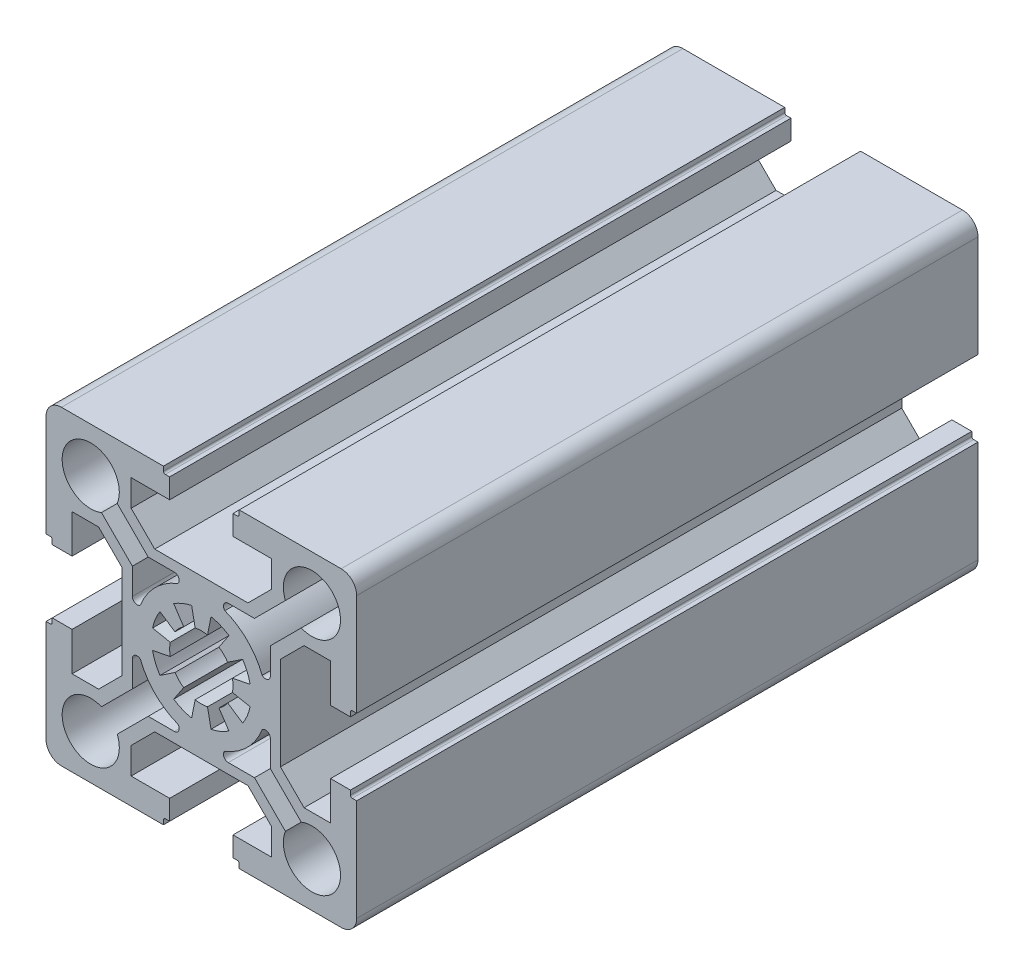
from build123d import *

# Parameters (mm, degrees)
EXTRUDE_1_DEPTH = 100


with BuildPart() as part:
    # 草图1 → 凸台-拉伸1 (new body)
    with BuildSketch(Plane.XY):
        with BuildLine():
            Line((-4.765977756, 26.059817672), (-21.165977756, 26.059817672))
            ThreePointArc((-21.165977756, 26.059817672), (-22.933744709, 25.327584625), (-23.665977756, 23.559817672))
            Line((-23.665977756, 23.559817672), (-23.665977756, 7.159817672))
            Line((-23.665977756, 7.159817672), (-22.965977756, 7.159817672))
            ThreePointArc((-22.965977756, 7.159817672), (-22.753845722, 7.071949706), (-22.665977756, 6.859817672))
            Line((-22.665977756, 6.859817672), (-22.665977756, 6.159817672))
            Line((-22.665977756, 6.159817672), (-19.465977756, 6.159817672))
            Line((-19.465977756, 6.159817672), (-19.465977756, 12.359817672))
            Line((-19.465977756, 12.359817672), (-15.198567937, 12.359817672))
            Line((-15.198567937, 12.359817672), (-11.398567937, 8.559817672))
            Line((-11.398567937, 8.559817672), (-11.398567937, 1.059817672))
            Line((-11.398567937, 1.059817672), (-11.398567937, -6.440182328))
            Line((-11.398567937, -6.440182328), (-15.198567937, -10.240182328))
            Line((-15.198567937, -10.240182328), (-19.465977756, -10.240182328))
            Line((-19.465977756, -10.240182328), (-19.465977756, -4.040182328))
            Line((-19.465977756, -4.040182328), (-22.665977756, -4.040182328))
            Line((-22.665977756, -4.040182328), (-22.665977756, -4.740182328))
            ThreePointArc((-22.665977756, -4.740182328), (-22.753845722, -4.952314363), (-22.965977756, -5.040182328))
            Line((-22.965977756, -5.040182328), (-23.665977756, -5.040182328))
            Line((-23.665977756, -5.040182328), (-23.665977756, -21.440182328))
            ThreePointArc((-23.665977756, -21.440182328), (-22.933744709, -23.207949281), (-21.165977756, -23.940182328))
            Line((-21.165977756, -23.940182328), (-4.765977756, -23.940182328))
            Line((-4.765977756, -23.940182328), (-4.765977756, -23.240182328))
            ThreePointArc((-4.765977756, -23.240182328), (-4.67810979, -23.028050294), (-4.465977756, -22.940182328))
            Line((-4.465977756, -22.940182328), (-3.765977756, -22.940182328))
            Line((-3.765977756, -22.940182328), (-3.765977756, -19.740182328))
            Line((-3.765977756, -19.740182328), (-9.965977756, -19.740182328))
            Line((-9.965977756, -19.740182328), (-9.965977756, -15.472772509))
            Line((-9.965977756, -15.472772509), (-6.165977756, -11.672772509))
            Line((-6.165977756, -11.672772509), (1.334022244, -11.672772509))
            Line((1.334022244, -11.672772509), (8.834022244, -11.672772509))
            Line((8.834022244, -11.672772509), (12.634022244, -15.472772509))
            Line((12.634022244, -15.472772509), (12.634022244, -19.740182328))
            Line((12.634022244, -19.740182328), (6.434022244, -19.740182328))
            Line((6.434022244, -19.740182328), (6.434022244, -22.940182328))
            Line((6.434022244, -22.940182328), (7.134022244, -22.940182328))
            ThreePointArc((7.134022244, -22.940182328), (7.346154278, -23.028050294), (7.434022244, -23.240182328))
            Line((7.434022244, -23.240182328), (7.434022244, -23.940182328))
            Line((7.434022244, -23.940182328), (23.834022244, -23.940182328))
            ThreePointArc((23.834022244, -23.940182328), (25.601789197, -23.207949281), (26.334022244, -21.440182328))
            Line((26.334022244, -21.440182328), (26.334022244, -5.040182328))
            Line((26.334022244, -5.040182328), (25.634022244, -5.040182328))
            ThreePointArc((25.634022244, -5.040182328), (25.42189021, -4.952314363), (25.334022244, -4.740182328))
            Line((25.334022244, -4.740182328), (25.334022244, -4.040182328))
            Line((25.334022244, -4.040182328), (22.134022244, -4.040182328))
            Line((22.134022244, -4.040182328), (22.134022244, -10.240182328))
            Line((22.134022244, -10.240182328), (17.866612425, -10.240182328))
            Line((17.866612425, -10.240182328), (14.066612425, -6.440182328))
            Line((14.066612425, -6.440182328), (14.066612425, 1.059817672))
            Line((14.066612425, 1.059817672), (14.066612425, 8.559817672))
            Line((14.066612425, 8.559817672), (17.866612425, 12.359817672))
            Line((17.866612425, 12.359817672), (22.134022244, 12.359817672))
            Line((22.134022244, 12.359817672), (22.134022244, 6.159817672))
            Line((22.134022244, 6.159817672), (25.334022244, 6.159817672))
            Line((25.334022244, 6.159817672), (25.334022244, 6.859817672))
            ThreePointArc((25.334022244, 6.859817672), (25.42189021, 7.071949706), (25.634022244, 7.159817672))
            Line((25.634022244, 7.159817672), (26.334022244, 7.159817672))
            Line((26.334022244, 7.159817672), (26.334022244, 23.559817672))
            ThreePointArc((26.334022244, 23.559817672), (25.601789197, 25.327584625), (23.834022244, 26.059817672))
            Line((23.834022244, 26.059817672), (7.434022244, 26.059817672))
            Line((7.434022244, 26.059817672), (7.434022244, 25.359817672))
            ThreePointArc((7.434022244, 25.359817672), (7.346154278, 25.147685637), (7.134022244, 25.059817672))
            Line((7.134022244, 25.059817672), (6.434022244, 25.059817672))
            Line((6.434022244, 25.059817672), (6.434022244, 21.859817672))
            Line((6.434022244, 21.859817672), (12.634022244, 21.859817672))
            Line((12.634022244, 21.859817672), (12.634022244, 17.592407853))
            Line((12.634022244, 17.592407853), (8.834022244, 13.792407853))
            Line((8.834022244, 13.792407853), (1.334022244, 13.792407853))
            Line((1.334022244, 13.792407853), (-6.165977756, 13.792407853))
            Line((-6.165977756, 13.792407853), (-9.965977756, 17.592407853))
            Line((-9.965977756, 17.592407853), (-9.965977756, 21.859817672))
            Line((-9.965977756, 21.859817672), (-3.765977756, 21.859817672))
            Line((-3.765977756, 21.859817672), (-3.765977756, 25.059817672))
            Line((-3.765977756, 25.059817672), (-4.465977756, 25.059817672))
            ThreePointArc((-4.465977756, 25.059817672), (-4.67810979, 25.147685637), (-4.765977756, 25.359817672))
            Line((-4.765977756, 25.359817672), (-4.765977756, 26.059817672))
        make_face()
        with BuildLine():
            Line((-9.765977756, 5.391903688), (-9.765977756, 9.61423326))
            Line((-9.765977756, 9.61423326), (-14.745444053, 14.593699556))
            ThreePointArc((-14.745444053, 14.593699556), (-19.718668949, 22.112508865), (-12.19985964, 17.139283969))
            Line((-12.19985964, 17.139283969), (-7.220393344, 12.159817672))
            Line((-7.220393344, 12.159817672), (-2.998063772, 12.159817672))
            ThreePointArc((-2.998063772, 12.159817672), (-2.29011, 11.688982743), (-2.450583757, 10.854038285))
            ThreePointArc((-2.450583757, 10.854038285), (-6.090598958, 8.484438874), (-8.460198369, 4.844423672))
            ThreePointArc((-8.460198369, 4.844423672), (-9.295142827, 4.683949916), (-9.765977756, 5.391903688))
        make_face(mode=Mode.SUBTRACT)
        with BuildLine():
            Line((-3.11053962, -5.591939227), (-1.499385944, -3.180677351))
            ThreePointArc((-1.499385944, -3.180677351), (-2.27222234, -2.546426912), (-2.906472779, -1.773590517))
            Line((-2.906472779, -1.773590517), (-5.317734654, -3.384744192))
            ThreePointArc((-5.317734654, -3.384744192), (-6.057014016, -2.001649787), (-6.512259999, -0.500904904))
            Line((-6.512259999, -0.500904904), (-3.667982686, 0.06485703))
            ThreePointArc((-3.667982686, 0.06485703), (-3.765977756, 1.059817672), (-3.667982686, 2.054778314))
            Line((-3.667982686, 2.054778314), (-6.512259999, 2.620540248))
            ThreePointArc((-6.512259999, 2.620540248), (-6.057014016, 4.121285131), (-5.317734654, 5.504379536))
            Line((-5.317734654, 5.504379536), (-2.906472779, 3.89322586))
            ThreePointArc((-2.906472779, 3.89322586), (-2.27222234, 4.666062256), (-1.499385944, 5.300312695))
            Line((-1.499385944, 5.300312695), (-3.11053962, 7.71157457))
            ThreePointArc((-3.11053962, 7.71157457), (-1.727445215, 8.450853932), (-0.226700332, 8.906099915))
            Line((-0.226700332, 8.906099915), (0.339061602, 6.061822602))
            ThreePointArc((0.339061602, 6.061822602), (1.334022244, 6.159817672), (2.328982886, 6.061822602))
            Line((2.328982886, 6.061822602), (2.89474482, 8.906099915))
            ThreePointArc((2.89474482, 8.906099915), (4.395489703, 8.450853932), (5.778584108, 7.71157457))
            Line((5.778584108, 7.71157457), (4.167430432, 5.300312695))
            ThreePointArc((4.167430432, 5.300312695), (4.940266828, 4.666062256), (5.574517267, 3.89322586))
            Line((5.574517267, 3.89322586), (7.985779142, 5.504379536))
            ThreePointArc((7.985779142, 5.504379536), (8.725058504, 4.121285131), (9.180304487, 2.620540248))
            Line((9.180304487, 2.620540248), (6.336027174, 2.054778314))
            ThreePointArc((6.336027174, 2.054778314), (6.434022244, 1.059817672), (6.336027174, 0.06485703))
            Line((6.336027174, 0.06485703), (9.180304487, -0.500904904))
            ThreePointArc((9.180304487, -0.500904904), (8.725058504, -2.001649787), (7.985779142, -3.384744192))
            Line((7.985779142, -3.384744192), (5.574517267, -1.773590517))
            ThreePointArc((5.574517267, -1.773590517), (4.940266828, -2.546426912), (4.167430432, -3.180677351))
            Line((4.167430432, -3.180677351), (5.778584108, -5.591939227))
            ThreePointArc((5.778584108, -5.591939227), (4.395489703, -6.331218588), (2.89474482, -6.786464571))
            Line((2.89474482, -6.786464571), (2.328982886, -3.942187258))
            ThreePointArc((2.328982886, -3.942187258), (1.334022244, -4.040182328), (0.339061602, -3.942187258))
            Line((0.339061602, -3.942187258), (-0.226700332, -6.786464571))
            ThreePointArc((-0.226700332, -6.786464571), (-1.727445215, -6.331218588), (-3.11053962, -5.591939227))
        make_face(mode=Mode.SUBTRACT)
        with BuildLine():
            Line((12.434022244, 5.391903688), (12.434022244, 9.61423326))
            Line((12.434022244, 9.61423326), (17.413488541, 14.593699556))
            ThreePointArc((17.413488541, 14.593699556), (22.386713437, 22.112508865), (14.867904128, 17.139283969))
            Line((14.867904128, 17.139283969), (9.888437832, 12.159817672))
            Line((9.888437832, 12.159817672), (5.66610826, 12.159817672))
            ThreePointArc((5.66610826, 12.159817672), (4.958154488, 11.688982743), (5.118628245, 10.854038285))
            ThreePointArc((5.118628245, 10.854038285), (8.758643446, 8.484438874), (11.128242857, 4.844423672))
            ThreePointArc((11.128242857, 4.844423672), (11.963187315, 4.683949916), (12.434022244, 5.391903688))
        make_face(mode=Mode.SUBTRACT)
        with BuildLine():
            Line((-9.765977756, -3.272268344), (-9.765977756, -7.494597916))
            Line((-9.765977756, -7.494597916), (-14.745444053, -12.474064213))
            ThreePointArc((-14.745444053, -12.474064213), (-19.718668949, -19.992873522), (-12.19985964, -15.019648625))
            Line((-12.19985964, -15.019648625), (-7.220393344, -10.040182328))
            Line((-7.220393344, -10.040182328), (-2.998063772, -10.040182328))
            ThreePointArc((-2.998063772, -10.040182328), (-2.29011, -9.569347399), (-2.450583757, -8.734402941))
            ThreePointArc((-2.450583757, -8.734402941), (-6.090598958, -6.364803531), (-8.460198369, -2.724788329))
            ThreePointArc((-8.460198369, -2.724788329), (-9.295142827, -2.564314572), (-9.765977756, -3.272268344))
        make_face(mode=Mode.SUBTRACT)
        with BuildLine():
            Line((12.434022244, -3.272268344), (12.434022244, -7.494597916))
            Line((12.434022244, -7.494597916), (17.413488541, -12.474064213))
            ThreePointArc((17.413488541, -12.474064213), (22.386713437, -19.992873522), (14.867904128, -15.019648625))
            Line((14.867904128, -15.019648625), (9.888437832, -10.040182328))
            Line((9.888437832, -10.040182328), (5.66610826, -10.040182328))
            ThreePointArc((5.66610826, -10.040182328), (4.958154488, -9.569347399), (5.118628245, -8.734402941))
            ThreePointArc((5.118628245, -8.734402941), (8.758643446, -6.364803531), (11.128242857, -2.724788329))
            ThreePointArc((11.128242857, -2.724788329), (11.963187315, -2.564314572), (12.434022244, -3.272268344))
        make_face(mode=Mode.SUBTRACT)
    extrude(amount=EXTRUDE_1_DEPTH)


solid = part.part
